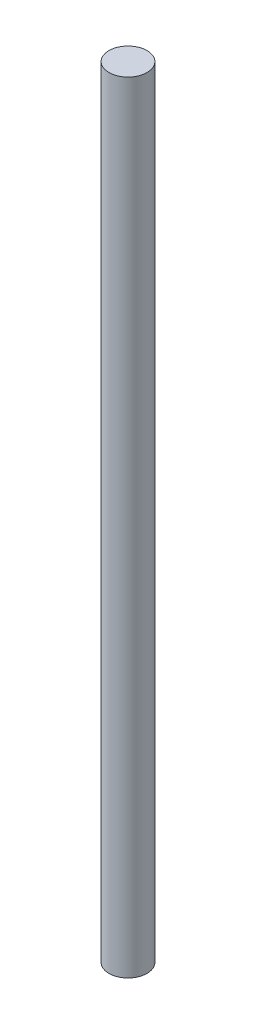
from build123d import *

# Parameters (mm, degrees)
SKETCH_1_R      = 1
EXTRUDE_1_DEPTH = 41


with BuildPart() as part:
    # 草图1 → 凸台-拉伸1 (new body)
    with BuildSketch(Plane(origin=(0, 0, 0), x_dir=(1, 0, 0), z_dir=(0, 1, 0))):
        with Locations(Location((0, 0, 0), (0, 0, 270))):
            Circle(SKETCH_1_R)
    extrude(amount=EXTRUDE_1_DEPTH)


solid = part.part
